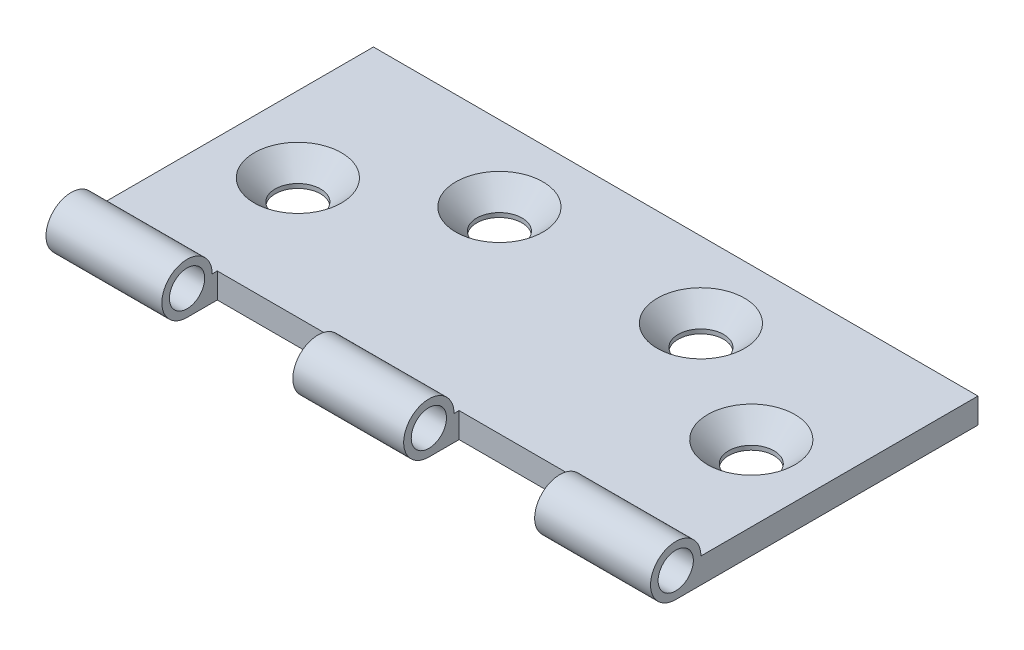
from build123d import *

# Parameters (mm, degrees)
SKIZZE1_W                                      = 5
SKIZZE1_H                                      = 60
LINEAR_AUSTRAGEN_D_NN1_DEPTH                   = 60
SKIZZE2_R                                      = 5
SKIZZE3_R                                      = 3.5
SCHNITT_LINEAR_AUSTRAGEN1_DEPTH                = 137.839321834
FORMSENKUNG_F_R_M8_LINSENSENKSCHRAUBE1_A_COUNT = 2
FORMSENKUNG_F_R_M8_LINSENSENKSCHRAUBE1_A_PITCH = 29.154759474
F_2CUT_DEPTH                                   = 89.600225733
F_2CUT_DEPTH_BACK                              = 89.600225733
SKIZZE10_W                                     = 26
SKIZZE10_H                                     = 11


with BuildPart() as part:
    # Skizze1 → Linear-Austragen-Dünn1 (new, symmetric)
    with BuildSketch(Plane.YZ):
        with Locations((2.5, 30)):
            Rectangle(SKIZZE1_W, SKIZZE1_H)
    extrude(amount=LINEAR_AUSTRAGEN_D_NN1_DEPTH, both=True)

    # Austragung1: sweep along a curve in space
    with BuildLine() as austragung1_path:
        Line((60, 5, 60), (-60, 5, 60))
    # Skizze2 → Austragung1 (sweep)
    with BuildSketch(Plane.YZ.offset(60)):
        with Locations((5, 60)):
            Circle(SKIZZE2_R)
    sweep(path=austragung1_path.line)

    # Skizze3 → Schnitt-Linear austragen1 (cut, through all)
    with BuildSketch(Plane.YZ.offset(60)):
        with Locations(Location((5, 60, 0), (0, 0, 270))):
            Circle(SKIZZE3_R)
    extrude(amount=-SCHNITT_LINEAR_AUSTRAGEN1_DEPTH, mode=Mode.SUBTRACT)

    # Skizze5 → Formsenkung für M8 Linsensenkschraube1 (revolve, cut)
    with BuildSketch(Plane(origin=(45, 5, 30), x_dir=(0, 0, 1), z_dir=(1, 0, 0))):
        Polygon((0, 0), (0, 5), (4.5, 5), (4.5, 4.15), (8.65, 0), align=None)
    formsenkung_f_r_m8_linsensenkschraube1 = revolve(axis=Axis((45, 11.35, 30), (0, -1, 0)), mode=Mode.SUBTRACT)

    # Formsenkung für M8 Linsensenkschraube1 a: Formsenkung für M8 Linsensenkschraube1 ×2
    with Locations(*[Vector(-0.8574929257125442, 0, -0.5144957554275265) * (i * FORMSENKUNG_F_R_M8_LINSENSENKSCHRAUBE1_A_PITCH) for i in range(1, FORMSENKUNG_F_R_M8_LINSENSENKSCHRAUBE1_A_COUNT)]):
        add(formsenkung_f_r_m8_linsensenkschraube1, mode=Mode.SUBTRACT)

    # Spiegeln1: Formsenkung für M8 Linsensenkschraube1 across plane
    add(formsenkung_f_r_m8_linsensenkschraube1.mirror(Plane(origin=(0, 0, 0), x_dir=(0, 0, 1), z_dir=(1, 0, 0))), mode=Mode.SUBTRACT)

    # Spiegeln1 copy 1 sketch → Spiegeln1 copy 1 (revolve, cut)
    with BuildSketch(Plane(origin=(-20, 5, 15), x_dir=(0, 0, 1), z_dir=(-1, 0, 0))):
        Polygon((0, 0), (0, -5), (4.5, -5), (4.5, -4.15), (8.65, 0), align=None)
    revolve(axis=Axis((-20, 11.35, 15), (0, 1, 0)), mode=Mode.SUBTRACT)

    # Skizze10 → 2Cut (cut, two sides: drawn at the far end of the back side and taken through both)
    with BuildSketch(Plane(origin=(0, 5, 0), x_dir=(-1, 0, 0), z_dir=(0, 1, 0)).offset(-F_2CUT_DEPTH_BACK)):
        with Locations((-24, 59.5)):
            Rectangle(SKIZZE10_W, SKIZZE10_H)
        with Locations((24, 59.5)):
            Rectangle(SKIZZE10_W, SKIZZE10_H)
    extrude(amount=F_2CUT_DEPTH + F_2CUT_DEPTH_BACK, mode=Mode.SUBTRACT)


solid = part.part
